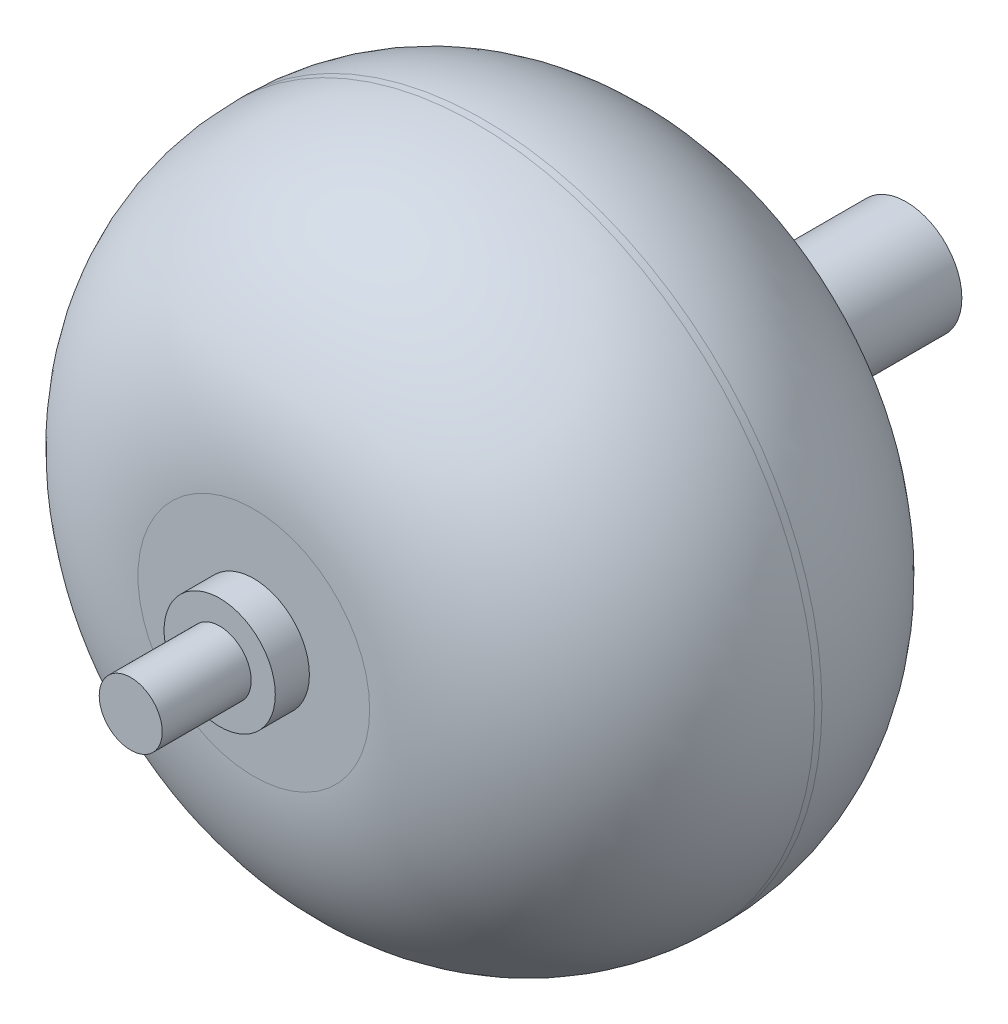
from build123d import *

# Parameters (mm, degrees)
SKETCH1_R           = 9.125
BOSS_EXTRUDE1_DEPTH = 12.2
SKETCH2_R           = 1.5
BOSS_EXTRUDE2_DEPTH = 5.4
BOSS_EXTRUDE3_START = 0.92
SKETCH4_R           = 1.5
BOSS_EXTRUDE3_DEPTH = 0.92
SKETCH5_R           = 0.85
BOSS_EXTRUDE4_DEPTH = 3.32
FILLET1_R           = 6


with BuildPart() as part:
    # Sketch1 → Boss-Extrude1 (new body)
    with BuildSketch(Plane.XY):
        Circle(SKETCH1_R)
    extrude(amount=BOSS_EXTRUDE1_DEPTH)

    # Sketch2 → Boss-Extrude2 (add)
    with BuildSketch(Plane(origin=(0, 0, 0), x_dir=(-1, 0, 0), z_dir=(0, 0, -1))):
        with Locations(Location((0, 0, 0), (0, 0, 180))):
            Circle(SKETCH2_R)
    extrude(amount=BOSS_EXTRUDE2_DEPTH)

    # Sketch4 → Boss-Extrude3 (add)
    with BuildSketch(Plane.XY.offset(12.2).offset(BOSS_EXTRUDE3_START)):
        Circle(SKETCH4_R)
    extrude(amount=-BOSS_EXTRUDE3_DEPTH)

    # Sketch5 → Boss-Extrude4 (add)
    with BuildSketch(Plane.XY.offset(12.2)):
        with Locations(Location((0, 0, 0), (0, 0, 180))):
            Circle(SKETCH5_R)
    extrude(amount=BOSS_EXTRUDE4_DEPTH)

    # Fillet1
    fillet1_edges = [part.edges().sort_by_distance(p)[0] for p in [
        (-9.125, 0, 0),
        (-9.125, 0, 12.2),
    ]]
    fillet(fillet1_edges, radius=FILLET1_R)


solid = part.part
